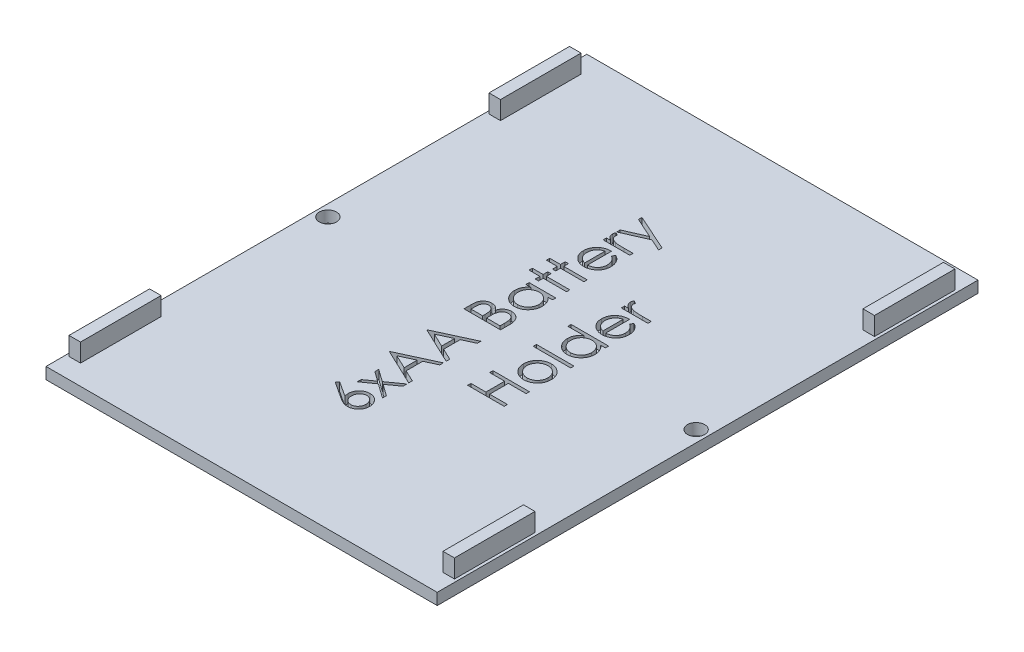
from build123d import *

# Parameters (mm, degrees)
SKETCH1_W               = 68
SKETCH1_H               = 94
BOSS_EXTRUDE1_DEPTH     = 2
SKETCH2_W               = 2
SKETCH2_H               = 14
BOSS_EXTRUDE2_DEPTH     = 3.175
MIRROR2_COPY_1_SKETCH_W = 2
MIRROR2_COPY_1_SKETCH_H = 14
MIRROR2_COPY_1_DEPTH    = 3.175
SKETCH3_W               = 6.512820513
SKETCH3_H               = 0.569871795
CUT_EXTRUDE1_DEPTH      = 1.5
SKETCH4_R               = 1.5
CUT_EXTRUDE2_DEPTH      = 59.095444238


with BuildPart() as part:
    # Sketch1 → Boss-Extrude1 (new body)
    with BuildSketch(Plane(origin=(0, 0, 0), x_dir=(1, 0, 0), z_dir=(0, 1, 0))):
        Rectangle(SKETCH1_W, SKETCH1_H)
    extrude(amount=BOSS_EXTRUDE1_DEPTH)

    # Sketch2 → Boss-Extrude2 (add)
    with BuildSketch(Plane(origin=(0, 2, 0), x_dir=(1, 0, 0), z_dir=(0, 1, 0))):
        with Locations((-32.5, -36.5)):
            Rectangle(SKETCH2_W, SKETCH2_H)
    boss_extrude2 = extrude(amount=BOSS_EXTRUDE2_DEPTH)

    # Mirror1: Boss-Extrude2 across plane
    add(boss_extrude2.mirror(Plane(origin=(0, 0, 0), x_dir=(0, 0, 1), z_dir=(1, 0, 0))))

    # Mirror2: Boss-Extrude2 across plane
    add(boss_extrude2.mirror(Plane.XY))

    # Mirror2 copy 1 sketch → Mirror2 copy 1 (add)
    with BuildSketch(Plane(origin=(0, 2, 0), x_dir=(-1, 0, 0), z_dir=(0, 1, 0))):
        with Locations((-32.5, -36.5)):
            Rectangle(MIRROR2_COPY_1_SKETCH_W, MIRROR2_COPY_1_SKETCH_H)
    extrude(amount=MIRROR2_COPY_1_DEPTH)

    # Sketch3 → Cut-Extrude1 (cut)
    # profile 1 of 17: a face of its own
    with BuildSketch(Plane(origin=(0, 2, 0), x_dir=(1, 0, 0), z_dir=(0, 1, 0))):
        with BuildLine():
            Line((-6.512820513, -24.219551282), (-6.168098958, -23.780699119))
            Line((-6.168098958, -23.780699119), (-3.602403846, -25.458513622))
            add(Edge.make_bspline(
                [(-3.602403846, -25.458513622), (-3.620208993, -25.346807548), (-3.654939946, -25.12891222), (-3.660669361, -24.908356947), (-3.663461538, -24.800871394)],
                knots=[0, 0, 0, 0, 1.025318673, 2, 2, 2, 2], degree=3))
            add(Edge.make_bspline(
                [(-3.663461538, -24.800871394), (-3.661726879, -24.736332722), (-3.658312253, -24.609290267), (-3.632034408, -24.422769356), (-3.590623137, -24.243537994), (-3.530257747, -24.072339094), (-3.453146375, -23.908558018), (-3.360728551, -23.751255458), (-3.24823314, -23.603386152), (-3.122564373, -23.463054304), (-2.983386582, -23.335622589), (-2.835669698, -23.222888692), (-2.679425403, -23.127675498), (-2.514688834, -23.051818618), (-2.342749525, -22.991195538), (-2.162936901, -22.948039283), (-1.974947478, -22.922239824), (-1.847076122, -22.918756567), (-1.782121394, -22.916987179)],
                knots=[0, 0, 0, 0, 1.043709831, 2.054511743, 3.041122595, 4.01515914, 4.98481438, 5.965901842, 6.960491961, 7.985277438, 9.0096037, 10.00832444, 10.987059228, 11.962929573, 12.936966118, 13.931840027, 14.949438142, 16, 16, 16, 16], degree=3))
            add(Edge.make_bspline(
                [(-1.782121394, -22.916987179), (-1.693254891, -22.919562824), (-1.518386645, -22.924631081), (-1.263750699, -22.975346177), (-1.021308894, -23.053564229), (-0.795256357, -23.167153875), (-0.584027426, -23.305570811), (-0.397481311, -23.476442176), (-0.231111911, -23.67129028), (-0.092049871, -23.891725732), (0.021534013, -24.128924395), (0.103112731, -24.378121868), (0.153338738, -24.636887813), (0.159635364, -24.812519092), (0.162820513, -24.901362179)],
                knots=[0, 0, 0, 0, 1.031403119, 2.029557249, 3.004870281, 3.983165322, 4.960181699, 5.929903783, 6.912123683, 7.928973898, 8.949315281, 9.960468141, 10.968302741, 12, 12, 12, 12], degree=3))
            add(Edge.make_bspline(
                [(0.162820513, -24.901362179), (0.16005579, -24.986812647), (0.154579358, -25.156075062), (0.105540204, -25.40500196), (0.026621437, -25.64461393), (-0.08438306, -25.871835219), (-0.22222742, -26.082670775), (-0.387017086, -26.272802056), (-0.578980993, -26.437133395), (-0.793919816, -26.575122257), (-1.024564459, -26.685030357), (-1.265475824, -26.766681932), (-1.515642512, -26.814628054), (-1.685247148, -26.821312624), (-1.770673077, -26.824679487)],
                knots=[0, 0, 0, 0, 1.012172929, 2.004937354, 2.995255351, 3.995689452, 4.993936421, 5.973737378, 6.968231049, 7.979117505, 8.993136101, 9.989812463, 10.987515067, 12, 12, 12, 12], degree=3))
            add(Edge.make_bspline(
                [(-1.770673077, -26.824679487), (-1.836068249, -26.822536008), (-1.969592697, -26.818159434), (-2.17182029, -26.787600712), (-2.378741538, -26.738497441), (-2.55428129, -26.683505994), (-2.698084337, -26.625402387), (-2.814023527, -26.577047066), (-2.933332902, -26.516859959), (-3.060103642, -26.452682538), (-3.191068641, -26.378737933), (-3.328416727, -26.298336684), (-3.469963539, -26.209255889), (-3.566019436, -26.146807879), (-3.615124199, -26.114883814)],
                knots=[0, 0, 0, 0, 1.173818275, 2.396712641, 3.66331629, 4.989737886, 5.693666774, 6.447286557, 7.243889047, 8.091586357, 8.998013824, 9.943181721, 10.948533338, 12, 12, 12, 12], degree=3))
            Line((-3.615124199, -26.114883814), (-6.512820513, -24.219551282))
        make_face()
        with BuildLine():
            add(Edge.make_bspline(
                [(-3.012179487, -24.920442708), (-3.010781522, -24.968820351), (-3.008050889, -25.06331594), (-2.991848738, -25.201874902), (-2.962358978, -25.333437386), (-2.921468854, -25.458041579), (-2.871056118, -25.57645616), (-2.806372151, -25.686334481), (-2.731030092, -25.789937588), (-2.645166241, -25.885610176), (-2.551220259, -25.972373813), (-2.450579493, -26.047086821), (-2.34568884, -26.111534949), (-2.235666812, -26.163934729), (-2.120556793, -26.204738177), (-2.000887853, -26.234253425), (-1.875857616, -26.250679519), (-1.791071504, -26.253412253), (-1.747776442, -26.254807692)],
                knots=[0, 0, 0, 0, 1.129656352, 2.206547016, 3.251334079, 4.271920891, 5.265058649, 6.249872215, 7.241923875, 8.251504132, 9.246416584, 10.222533834, 11.173322129, 12.116503788, 13.062124155, 14.020151864, 14.989013135, 16, 16, 16, 16], degree=3))
            add(Edge.make_bspline(
                [(-1.747776442, -26.254807692), (-1.704876118, -26.253631051), (-1.620335767, -26.251312336), (-1.496239164, -26.231570807), (-1.377091092, -26.200016032), (-1.26333933, -26.154433033), (-1.152800145, -26.099040609), (-1.048924161, -26.027940169), (-0.948346618, -25.946337521), (-0.855740682, -25.851058975), (-0.769769105, -25.74802515), (-0.694312993, -25.638176481), (-0.630507026, -25.523166922), (-0.577636733, -25.403327711), (-0.538716656, -25.277177481), (-0.50892122, -25.146764595), (-0.49263165, -25.010315936), (-0.48986982, -24.917937768), (-0.488461538, -24.870833333)],
                knots=[0, 0, 0, 0, 0.989367052, 1.949669134, 2.891858276, 3.827522767, 4.772653562, 5.738670152, 6.725809442, 7.756636004, 8.798867547, 9.819240912, 10.826537776, 11.829883227, 12.835515726, 13.868058748, 14.912904531, 16, 16, 16, 16], degree=3))
            add(Edge.make_bspline(
                [(-0.488461538, -24.870833333), (-0.489869929, -24.823728976), (-0.492631974, -24.73135096), (-0.508919986, -24.594901202), (-0.538721179, -24.464492372), (-0.577620345, -24.338327408), (-0.63056819, -24.218542843), (-0.693913695, -24.103633816), (-0.77023176, -23.994824076), (-0.85559307, -23.891723198), (-0.948875787, -23.796840615), (-1.048017908, -23.71331876), (-1.153631311, -23.644439651), (-1.262904692, -23.586850957), (-1.377159035, -23.541772676), (-1.496220621, -23.510062552), (-1.620340605, -23.49036302), (-1.704877747, -23.488038541), (-1.747776442, -23.486858974)],
                knots=[0, 0, 0, 0, 1.087281468, 2.132306021, 3.165025708, 4.170830268, 5.174347389, 6.181816599, 7.194310624, 8.23672049, 9.267723423, 10.261267456, 11.222032883, 12.171822355, 13.107646935, 14.049997283, 15.01046367, 16, 16, 16, 16], degree=3))
            add(Edge.make_bspline(
                [(-1.747776442, -23.486858974), (-1.791127985, -23.487857363), (-1.876212965, -23.489816875), (-2.000831925, -23.511980098), (-2.121164814, -23.542718399), (-2.236455265, -23.589133348), (-2.346248664, -23.649433851), (-2.451098302, -23.722882648), (-2.551813218, -23.807849017), (-2.64535008, -23.906002456), (-2.730937004, -24.01282699), (-2.806268533, -24.126499802), (-2.870571835, -24.244948134), (-2.921312231, -24.369840505), (-2.96218927, -24.499496498), (-2.991743596, -24.634811406), (-3.008008654, -24.775881469), (-3.010771501, -24.871641866), (-3.012179487, -24.920442708)],
                knots=[0, 0, 0, 0, 0.978259475, 1.920005202, 2.851759169, 3.7803069, 4.719124913, 5.675758531, 6.668034766, 7.691045932, 8.733780038, 9.756656648, 10.768121246, 11.773215211, 12.79725739, 13.836288844, 14.897342417, 16, 16, 16, 16], degree=3))
        make_face(mode=Mode.SUBTRACT)
    # profile 2 of 17: a face of its own
    with BuildSketch(Plane(origin=(0, 2, 0), x_dir=(1, 0, 0), z_dir=(0, 1, 0))):
        Polygon((-4.640384615, -22.265705128), (-4.640384615, -21.587710337), (-2.966386218, -20.393269231), (-4.640384615, -19.198828125), (-4.640384615, -18.520833333), (-2.491917067, -20.053635817), (0, -18.276602564), (0, -18.954597356), (-2.016175881, -20.393269231), (0, -21.831941106), (0, -22.509935897), (-2.491917067, -20.731630609), align=None)
    # profile 3 of 17: a face of its own
    with BuildSketch(Plane(origin=(0, 2, 0), x_dir=(1, 0, 0), z_dir=(0, 1, 0))):
        Polygon((-6.35, -14.857371795), (0, -11.926602564), (0, -12.546083734), (-2.03525641, -13.484845753), (-2.03525641, -16.363461538), (0, -17.328936298), (0, -17.950961538), (-6.35, -14.938782051), align=None)
        Polygon((-5.112309696, -14.904437099), (-2.686538462, -16.054356971), (-2.686538462, -13.785046074), align=None, mode=Mode.SUBTRACT)
    # profile 4 of 17: a face of its own
    with BuildSketch(Plane(origin=(0, 2, 0), x_dir=(1, 0, 0), z_dir=(0, 1, 0))):
        Polygon((-6.35, -8.344551282), (0, -5.413782051), (0, -6.033263221), (-2.03525641, -6.97202524), (-2.03525641, -9.850641026), (0, -10.816115785), (0, -11.438141026), (-6.35, -8.425961538), align=None)
        Polygon((-5.112309696, -8.391616587), (-2.686538462, -9.541536458), (-2.686538462, -7.272225561), align=None, mode=Mode.SUBTRACT)
    # profile 5 of 17: a face of its own
    with BuildSketch(Plane(origin=(0, 2, 0), x_dir=(1, 0, 0), z_dir=(0, 1, 0))):
        with BuildLine():
            Line((-6.35, -1.994551282), (-6.35, -0.755588942))
            add(Edge.make_bspline(
                [(-6.35, -0.755588942), (-6.349686158, -0.694939175), (-6.349077855, -0.577384833), (-6.339424525, -0.406456844), (-6.326591336, -0.246303258), (-6.305064352, -0.097207087), (-6.282743708, 0.041801818), (-6.249982348, 0.169312222), (-6.213796231, 0.286392184), (-6.15811898, 0.426981255), (-6.071651506, 0.58649882), (-5.943412027, 0.757950354), (-5.789663247, 0.906986488), (-5.614454384, 1.03371138), (-5.421704781, 1.135410801), (-5.215561507, 1.208055045), (-4.999492675, 1.254724474), (-4.851357514, 1.259463797), (-4.776492388, 1.261858974)],
                knots=[0, 0, 0, 0, 1.00128172, 1.940733171, 2.826250472, 3.653024905, 4.427672124, 5.149348099, 5.824709082, 6.450061444, 7.643590664, 8.808605388, 9.972104426, 11.165284501, 12.367876273, 13.557044126, 14.765369432, 16, 16, 16, 16], degree=3))
            add(Edge.make_bspline(
                [(-4.776492388, 1.261858974), (-4.706368692, 1.259863966), (-4.568569016, 1.255943587), (-4.367368648, 1.218912255), (-4.176038859, 1.160138239), (-3.994743401, 1.078910178), (-3.826857102, 0.974252366), (-3.672900029, 0.848857596), (-3.538690913, 0.698196782), (-3.463688681, 0.585260928), (-3.425590946, 0.527894631)],
                knots=[0, 0, 0, 0, 1.044641374, 2.052818814, 3.038628718, 4.023282556, 5.005660861, 5.98021751, 6.974042014, 8, 8, 8, 8], degree=3))
            add(Edge.make_bspline(
                [(-3.425590946, 0.527894631), (-3.397886908, 0.600024442), (-3.344882222, 0.738026636), (-3.251317083, 0.928047342), (-3.14918179, 1.091165211), (-3.039368108, 1.230566668), (-2.919254902, 1.349161224), (-2.787866309, 1.451870966), (-2.645309891, 1.54066554), (-2.492109588, 1.616229108), (-2.329564148, 1.675585233), (-2.159658903, 1.719211163), (-1.983045186, 1.745016848), (-1.863191581, 1.748537139), (-1.802473958, 1.750320513)],
                knots=[0, 0, 0, 0, 1.272586185, 2.434772614, 3.483318042, 4.437947805, 5.351807173, 6.25737843, 7.180033415, 8.1141739, 9.066731021, 10.025721652, 10.999834114, 12, 12, 12, 12], degree=3))
            add(Edge.make_bspline(
                [(-1.802473958, 1.750320513), (-1.740485238, 1.748548622), (-1.618520694, 1.745062378), (-1.439354268, 1.719330325), (-1.268117908, 1.67579128), (-1.103782939, 1.615715955), (-0.946693913, 1.537848334), (-0.797419911, 1.441716397), (-0.65565037, 1.328669644), (-0.521135084, 1.20090854), (-0.398049369, 1.058528784), (-0.292237163, 0.90161713), (-0.201253746, 0.734472191), (-0.127178292, 0.55495718), (-0.070029129, 0.36353036), (-0.030211881, 0.160298252), (-0.003338063, -0.054404451), (-0.001131568, -0.201743221), (0, -0.277303686)],
                knots=[0, 0, 0, 0, 0.978680899, 1.925582087, 2.851223405, 3.764209995, 4.683484765, 5.614004905, 6.562443559, 7.542772147, 8.539900013, 9.527881485, 10.525548727, 11.540192123, 12.58875426, 13.674701727, 14.807505862, 16, 16, 16, 16], degree=3))
            Line((0, -0.277303686), (0, -1.994551282))
            Line((0, -1.994551282), (-6.35, -1.994551282))
        make_face()
        with BuildLine():
            Line((-5.698717949, -1.424679487), (-3.663461538, -1.424679487))
            Line((-3.663461538, -1.424679487), (-3.663461538, -1.041796875))
            add(Edge.make_bspline(
                [(-3.663461538, -1.041796875), (-3.664187113, -0.985828346), (-3.665589071, -0.877685743), (-3.669605025, -0.721076789), (-3.680850041, -0.575707108), (-3.692091847, -0.441827658), (-3.710369976, -0.319649163), (-3.732127283, -0.209442641), (-3.755137147, -0.109477404), (-3.794272678, 0.005798787), (-3.852092151, 0.136578019), (-3.941910369, 0.275902883), (-4.048805389, 0.399299377), (-4.173301164, 0.502251206), (-4.308898954, 0.587253311), (-4.454408338, 0.646799959), (-4.606901127, 0.686497937), (-4.711789768, 0.690138689), (-4.765044071, 0.691987179)],
                knots=[0, 0, 0, 0, 1.156917035, 2.235399477, 3.236897345, 4.169954739, 5.01148057, 5.788325709, 6.491867502, 7.129259015, 8.302032419, 9.437271567, 10.542795419, 11.662606952, 12.764338259, 13.836858145, 14.901724648, 16, 16, 16, 16], degree=3))
            add(Edge.make_bspline(
                [(-4.765044071, 0.691987179), (-4.80029259, 0.691048629), (-4.869436411, 0.689207561), (-4.970559604, 0.673581439), (-5.065578315, 0.648262973), (-5.155404483, 0.613974944), (-5.237805714, 0.56713241), (-5.31671935, 0.512835758), (-5.387418853, 0.445798832), (-5.453307969, 0.370041154), (-5.512278508, 0.283360858), (-5.56112646, 0.183890416), (-5.605398934, 0.07420129), (-5.638172531, -0.048682445), (-5.666991771, -0.182214597), (-5.685099092, -0.32820324), (-5.696751325, -0.485723275), (-5.698047786, -0.594864876), (-5.698717949, -0.651282051)],
                knots=[0, 0, 0, 0, 0.911708768, 1.788416306, 2.640049961, 3.452993646, 4.268229297, 5.087074648, 5.92553149, 6.781184137, 7.681934069, 8.628939405, 9.643570426, 10.73771997, 11.914765019, 13.176320755, 14.540391495, 16, 16, 16, 16], degree=3))
            Line((-5.698717949, -0.651282051), (-5.698717949, -1.424679487))
        make_face(mode=Mode.SUBTRACT)
        with BuildLine():
            Line((-3.012179487, -1.424679487), (-0.651282051, -1.424679487))
            Line((-0.651282051, -1.424679487), (-0.651282051, -0.613120994))
            add(Edge.make_bspline(
                [(-0.651282051, -0.613120994), (-0.652047507, -0.555035589), (-0.653522822, -0.44308363), (-0.656982743, -0.281316944), (-0.670071099, -0.131775486), (-0.682145048, 0.006012492), (-0.702790982, 0.131681302), (-0.722275376, 0.246197594), (-0.751198566, 0.347681504), (-0.790950089, 0.466441159), (-0.854587342, 0.599187003), (-0.947560769, 0.744254316), (-1.062304329, 0.870750765), (-1.192803399, 0.979336158), (-1.334304214, 1.06894554), (-1.484956921, 1.133248748), (-1.641831611, 1.173209054), (-1.748818713, 1.178030639), (-1.802473958, 1.180448718)],
                knots=[0, 0, 0, 0, 1.160376723, 2.23647316, 3.230273494, 4.158083346, 4.997711197, 5.773399541, 6.476071462, 7.102777513, 8.27340052, 9.405620712, 10.53304798, 11.669441455, 12.787990954, 13.865552736, 14.929550474, 16, 16, 16, 16], degree=3))
            add(Edge.make_bspline(
                [(-1.802473958, 1.180448718), (-1.836026884, 1.17994932), (-1.902591525, 1.178958579), (-2.00039969, 1.163949098), (-2.09519127, 1.142235136), (-2.187361275, 1.113637223), (-2.275359988, 1.073658882), (-2.359524886, 1.024648787), (-2.441551442, 0.968548026), (-2.546593553, 0.881995162), (-2.666116905, 0.754265216), (-2.781692172, 0.572746708), (-2.876404985, 0.367493317), (-2.916445508, 0.218277136), (-2.937129407, 0.141195913)],
                knots=[0, 0, 0, 0, 0.723302347, 1.434937762, 2.129609326, 2.821140842, 3.513216847, 4.209993937, 4.920569932, 5.655069131, 7.14393391, 8.6716197, 10.280644748, 12, 12, 12, 12], degree=3))
            add(Edge.make_bspline(
                [(-2.937129407, 0.141195913), (-2.943397917, 0.110300268), (-2.956989338, 0.043312136), (-2.971336171, -0.065921617), (-2.984117923, -0.190628122), (-2.993572452, -0.331095342), (-3.003345181, -0.487500996), (-3.007145785, -0.66017912), (-3.011680157, -0.848424534), (-3.012008786, -0.979039267), (-3.012179487, -1.046885016)],
                knots=[0, 0, 0, 0, 0.634451884, 1.375622551, 2.216452059, 3.157844607, 4.20941857, 5.370758133, 6.634282058, 8, 8, 8, 8], degree=3))
            Line((-3.012179487, -1.046885016), (-3.012179487, -1.424679487))
        make_face(mode=Mode.SUBTRACT)
    # profile 6 of 17: a face of its own
    with BuildSketch(Plane(origin=(0, 2, 0), x_dir=(1, 0, 0), z_dir=(0, 1, 0))):
        with BuildLine():
            Line((-4.640384615, 7.611858974), (0, 7.611858974))
            Line((0, 7.611858974), (0, 7.041987179))
            Line((0, 7.041987179), (-0.802654247, 7.041987179))
            add(Edge.make_bspline(
                [(-0.802654247, 7.041987179), (-0.73013068, 6.977627053), (-0.588389557, 6.851840678), (-0.401516704, 6.643733369), (-0.250200979, 6.42039739), (-0.126216077, 6.187436897), (-0.033459119, 5.942569983), (0.032588195, 5.687076491), (0.075022466, 5.420712325), (0.07926189, 5.238826785), (0.081410256, 5.146654647)],
                knots=[0, 0, 0, 0, 1.074325654, 2.099677833, 3.090439787, 4.057542011, 5.018572219, 5.985274637, 6.979019747, 8, 8, 8, 8], degree=3))
            add(Edge.make_bspline(
                [(0.081410256, 5.146654647), (0.079185267, 5.064707074), (0.074797489, 4.903102831), (0.040757309, 4.665378648), (-0.013908247, 4.436611281), (-0.089928433, 4.216584557), (-0.190767923, 4.006722236), (-0.311492759, 3.805227489), (-0.455258265, 3.613144176), (-0.619610831, 3.433400098), (-0.79812745, 3.267879183), (-0.988528657, 3.12262516), (-1.189991122, 3.001516001), (-1.39996413, 2.900242426), (-1.620064056, 2.822234772), (-1.849529775, 2.767854036), (-2.088089974, 2.733853511), (-2.250540251, 2.729467547), (-2.33291266, 2.72724359)],
                knots=[0, 0, 0, 0, 1.033919861, 2.038935746, 3.024066025, 3.998881131, 4.97069526, 5.957263378, 6.95902576, 7.993208707, 9.027059324, 10.027763471, 11.009749337, 11.988697705, 12.965288445, 13.950418724, 14.960734635, 16, 16, 16, 16], degree=3))
            add(Edge.make_bspline(
                [(-2.33291266, 2.72724359), (-2.413582522, 2.729516838), (-2.573062488, 2.734010927), (-2.807610983, 2.76749034), (-3.033522685, 2.823789456), (-3.250070282, 2.902797693), (-3.457515801, 3.004110955), (-3.656005961, 3.127351912), (-3.846087582, 3.272529467), (-4.023291094, 3.439901691), (-4.186977065, 3.621211917), (-4.329233476, 3.815174901), (-4.452091188, 4.016965711), (-4.549433923, 4.229714316), (-4.628190441, 4.450271777), (-4.682678826, 4.6806016), (-4.714786824, 4.919745464), (-4.71943641, 5.082106786), (-4.721794872, 5.164463141)],
                knots=[0, 0, 0, 0, 1.020392517, 2.01726096, 2.990465484, 3.961182959, 4.928053699, 5.906110375, 6.912531644, 7.948652711, 8.985773172, 9.998621852, 10.987621588, 11.969261332, 12.953316658, 13.946091881, 14.958173133, 16, 16, 16, 16], degree=3))
            add(Edge.make_bspline(
                [(-4.721794872, 5.164463141), (-4.719183474, 5.259166806), (-4.714062647, 5.444876223), (-4.671535636, 5.716550972), (-4.599470314, 5.973442036), (-4.502118868, 6.218276561), (-4.370045566, 6.447684464), (-4.208102076, 6.664521532), (-4.009593081, 6.864174542), (-3.859018636, 6.981690994), (-3.781760817, 7.041987179)],
                knots=[0, 0, 0, 0, 1.039007978, 2.037445607, 3.008437381, 3.96246474, 4.921201921, 5.904967172, 6.925065498, 8, 8, 8, 8], degree=3))
            Line((-3.781760817, 7.041987179), (-4.640384615, 7.041987179))
            Line((-4.640384615, 7.041987179), (-4.640384615, 7.611858974))
        make_face()
        with BuildLine():
            add(Edge.make_bspline(
                [(-4.151923077, 5.172095353), (-4.148956655, 5.088795418), (-4.143101409, 4.924374597), (-4.097466181, 4.682968838), (-4.02133771, 4.452083352), (-3.917832134, 4.232077167), (-3.785211951, 4.029085297), (-3.628960889, 3.844482747), (-3.446441489, 3.683961535), (-3.244185597, 3.54591368), (-3.026158718, 3.435092124), (-2.798319046, 3.35667095), (-2.564609633, 3.30504641), (-2.406111482, 3.299765943), (-2.326552484, 3.297115385)],
                knots=[0, 0, 0, 0, 1.031130969, 2.035288524, 3.029955243, 4.035265425, 5.037320146, 6.024362013, 7.021230137, 8.037832003, 9.049975902, 10.039737725, 11.016035826, 12, 12, 12, 12], degree=3))
            add(Edge.make_bspline(
                [(-2.326552484, 3.297115385), (-2.24747257, 3.300512488), (-2.089622708, 3.307293379), (-1.855933355, 3.355540669), (-1.628605119, 3.437545519), (-1.408826205, 3.548217221), (-1.204594048, 3.687889793), (-1.018796389, 3.84825834), (-0.860101216, 4.03374906), (-0.727161318, 4.238555807), (-0.61984129, 4.457393494), (-0.545150416, 4.687501138), (-0.496931946, 4.924585483), (-0.491299374, 5.085788814), (-0.488461538, 5.167007212)],
                knots=[0, 0, 0, 0, 0.979154007, 1.954470061, 2.941101473, 3.965068436, 4.993389179, 5.998216918, 6.996159742, 8.005560442, 9.015493761, 10.005250788, 10.994993882, 12, 12, 12, 12], degree=3))
            add(Edge.make_bspline(
                [(-0.488461538, 5.167007212), (-0.491507979, 5.249448918), (-0.497567048, 5.413417294), (-0.542944087, 5.655808818), (-0.620757544, 5.890232607), (-0.72533078, 6.115089519), (-0.855579436, 6.324357893), (-1.008065428, 6.511542516), (-1.18418603, 6.671693365), (-1.379993319, 6.805030666), (-1.593287966, 6.910773661), (-1.820144968, 6.988091587), (-2.061024796, 7.033297327), (-2.225871347, 7.03905051), (-2.310016026, 7.041987179)],
                knots=[0, 0, 0, 0, 1.01787422, 2.024450869, 3.03297362, 4.061474925, 5.080076323, 6.069755756, 7.033548292, 8.009625779, 8.9862229, 9.964937832, 10.961217871, 12, 12, 12, 12], degree=3))
            add(Edge.make_bspline(
                [(-2.310016026, 7.041987179), (-2.374128947, 7.040246089), (-2.500323464, 7.036819071), (-2.685611961, 7.010637895), (-2.862928863, 6.9689911), (-3.032460599, 6.910305905), (-3.193269842, 6.833214575), (-3.346511235, 6.740236486), (-3.491387776, 6.629736598), (-3.62590449, 6.503493707), (-3.748598215, 6.365308268), (-3.858116194, 6.219086744), (-3.948084396, 6.063096732), (-4.022544989, 5.899961536), (-4.081798018, 5.729398115), (-4.121327119, 5.550018562), (-4.148469416, 5.363729543), (-4.150759736, 5.236645985), (-4.151923077, 5.172095353)],
                knots=[0, 0, 0, 0, 1.050140795, 2.067009409, 3.05949893, 4.030605086, 5.00011959, 5.97591094, 6.962425594, 7.979863591, 8.993523472, 9.986985069, 10.967611495, 11.937549037, 12.921786183, 13.919465291, 14.943216303, 16, 16, 16, 16], degree=3))
        make_face(mode=Mode.SUBTRACT)
    # profile 7 of 17: a face of its own
    with BuildSketch(Plane(origin=(0, 2, 0), x_dir=(1, 0, 0), z_dir=(0, 1, 0))):
        Polygon((-6.512820513, 9.484294872), (-6.512820513, 10.054166667), (-4.640384615, 10.054166667), (-4.640384615, 10.868269231), (-4.070512821, 10.868269231), (-4.070512821, 10.054166667), (0, 10.054166667), (0, 9.484294872), (-4.070512821, 9.484294872), (-4.070512821, 8.670192308), (-4.640384615, 8.670192308), (-4.640384615, 9.484294872), align=None)
    # profile 8 of 17: a face of its own
    with BuildSketch(Plane(origin=(0, 2, 0), x_dir=(1, 0, 0), z_dir=(0, 1, 0))):
        Polygon((-6.512820513, 12.496474359), (-6.512820513, 13.066346154), (-4.640384615, 13.066346154), (-4.640384615, 13.880448718), (-4.070512821, 13.880448718), (-4.070512821, 13.066346154), (0, 13.066346154), (0, 12.496474359), (-4.070512821, 12.496474359), (-4.070512821, 11.682371795), (-4.640384615, 11.682371795), (-4.640384615, 12.496474359), align=None)
    # profile 9 of 17: a face of its own
    with BuildSketch(Plane(origin=(0, 2, 0), x_dir=(1, 0, 0), z_dir=(0, 1, 0))):
        with BuildLine():
            Line((-1.465384615, 18.747255609), (-1.199529247, 19.253525641))
            add(Edge.make_bspline(
                [(-1.199529247, 19.253525641), (-1.127984738, 19.213160939), (-0.988787456, 19.134627213), (-0.797536398, 19.000121654), (-0.626508157, 18.857830006), (-0.478441385, 18.703422902), (-0.34768004, 18.54155328), (-0.234891068, 18.369146733), (-0.138039348, 18.18761051), (-0.058678401, 17.99494508), (0.003711762, 17.791381237), (0.049787323, 17.57573776), (0.076506771, 17.346996459), (0.079749708, 17.190354727), (0.081410256, 17.110146234)],
                knots=[0, 0, 0, 0, 1.120611642, 2.180266485, 3.186550691, 4.152466804, 5.095166165, 6.022949561, 6.960161436, 7.899497276, 8.862391909, 9.862399089, 10.905440174, 12, 12, 12, 12], degree=3))
            add(Edge.make_bspline(
                [(0.081410256, 17.110146234), (0.079328953, 17.020988646), (0.075268932, 16.847068022), (0.04026689, 16.59390305), (-0.016832964, 16.355543256), (-0.096599007, 16.132001996), (-0.200788619, 15.923826862), (-0.327714964, 15.730603527), (-0.476726885, 15.551318019), (-0.649111794, 15.391611845), (-0.833599584, 15.247859754), (-1.025806118, 15.12092583), (-1.225065762, 15.015298608), (-1.430192967, 14.928064159), (-1.6407216, 14.85925271), (-1.857857385, 14.810354233), (-2.080739315, 14.782426664), (-2.23149849, 14.77812787), (-2.307471955, 14.775961538)],
                knots=[0, 0, 0, 0, 1.14524686, 2.234044844, 3.276713788, 4.290115724, 5.276966211, 6.260758605, 7.254862358, 8.264742877, 9.274005885, 10.257798278, 11.220590477, 12.167824544, 13.118936889, 14.062732937, 15.023735098, 16, 16, 16, 16], degree=3))
            add(Edge.make_bspline(
                [(-2.307471955, 14.775961538), (-2.378764005, 14.777883123), (-2.520055432, 14.781691451), (-2.729180063, 14.80569588), (-2.932431684, 14.848237783), (-3.129979182, 14.906614828), (-3.321491797, 14.98200066), (-3.507086084, 15.074224829), (-3.686564552, 15.183431), (-3.799781666, 15.267745708), (-3.856810897, 15.310216346)],
                knots=[0, 0, 0, 0, 1.024358464, 2.0301432, 3.019427413, 4.004406732, 4.986367066, 5.972626655, 6.978780325, 8, 8, 8, 8], degree=3))
            add(Edge.make_bspline(
                [(-3.856810897, 15.310216346), (-3.925629764, 15.367643967), (-4.060866435, 15.48049558), (-4.236942543, 15.673348274), (-4.387560602, 15.879360018), (-4.510435112, 16.100603043), (-4.604945038, 16.336704677), (-4.672168699, 16.586447126), (-4.713998331, 16.850520672), (-4.719156513, 17.031545977), (-4.721794872, 17.124138622)],
                knots=[0, 0, 0, 0, 1.030811313, 2.025658015, 2.997072178, 3.962767568, 4.930766827, 5.917075773, 6.934604948, 8, 8, 8, 8], degree=3))
            add(Edge.make_bspline(
                [(-4.721794872, 17.124138622), (-4.719350544, 17.219299034), (-4.71455533, 17.405982071), (-4.669702284, 17.678105899), (-4.599437292, 17.936100786), (-4.497064534, 18.177837632), (-4.370166508, 18.407041248), (-4.209773346, 18.618436536), (-4.024123028, 18.817826436), (-3.881201208, 18.933762713), (-3.808473558, 18.992758413)],
                knots=[0, 0, 0, 0, 1.056389096, 2.072394598, 3.055233004, 4.020130009, 4.981825462, 5.957811105, 6.960805292, 8, 8, 8, 8], degree=3))
            add(Edge.make_bspline(
                [(-3.808473558, 18.992758413), (-3.753675631, 19.032903002), (-3.64444453, 19.112924963), (-3.466334003, 19.213158988), (-3.279987638, 19.300167404), (-3.082393242, 19.369714348), (-2.875892004, 19.426028871), (-2.659007673, 19.466771957), (-2.431804834, 19.490665408), (-2.276998083, 19.495362044), (-2.198076923, 19.49775641)],
                knots=[0, 0, 0, 0, 0.94817472, 1.890038105, 2.849395472, 3.817997239, 4.812318967, 5.836947057, 6.897266129, 8, 8, 8, 8], degree=3))
            Line((-2.198076923, 19.49775641), (-2.198076923, 15.345833333))
            add(Edge.make_bspline(
                [(-2.198076923, 15.345833333), (-2.136934652, 15.348626619), (-2.016700843, 15.354119503), (-1.840768136, 15.379728406), (-1.673176501, 15.420094038), (-1.515182982, 15.476825052), (-1.364724036, 15.545526329), (-1.222915769, 15.629683272), (-1.090404096, 15.730085034), (-0.966003718, 15.842073089), (-0.855222051, 15.96672739), (-0.756068114, 16.097868946), (-0.672963675, 16.237375842), (-0.605508732, 16.384148079), (-0.552701558, 16.537948318), (-0.516655655, 16.698825015), (-0.492512761, 16.866461598), (-0.489828226, 16.980735715), (-0.488461538, 17.03891226)],
                knots=[0, 0, 0, 0, 1.094153842, 2.151609401, 3.174256925, 4.172055639, 5.149267565, 6.128595816, 7.11444997, 8.118368179, 9.117203808, 10.09244225, 11.054858984, 12.015122123, 12.976791628, 13.957293641, 14.960065497, 16, 16, 16, 16], degree=3))
            add(Edge.make_bspline(
                [(-0.488461538, 17.03891226), (-0.489555843, 17.095794681), (-0.491727154, 17.208660316), (-0.513143055, 17.376700741), (-0.547085398, 17.542310229), (-0.595972696, 17.703844323), (-0.653219063, 17.858948866), (-0.720597667, 18.003377653), (-0.797416902, 18.135221264), (-0.88471234, 18.25892713), (-0.99184677, 18.378266139), (-1.124255561, 18.498525178), (-1.283440498, 18.624628421), (-1.402454333, 18.704841687), (-1.465384615, 18.747255609)],
                knots=[0, 0, 0, 0, 0.991168677, 1.966668791, 2.94808785, 3.9350306, 4.905702032, 5.828266021, 6.709360349, 7.562606342, 8.463112863, 9.498839253, 10.677475166, 12, 12, 12, 12], degree=3))
        make_face()
        with BuildLine():
            add(Edge.make_bspline(
                [(-2.767948718, 18.927884615), (-2.843574848, 18.90711092), (-2.988752449, 18.867232175), (-3.189718084, 18.782303456), (-3.369353734, 18.688961996), (-3.524674257, 18.576597244), (-3.662840511, 18.450528303), (-3.781651866, 18.302898525), (-3.891158015, 18.140110783), (-3.982350567, 17.958922674), (-4.057288895, 17.766479354), (-4.112391731, 17.566736293), (-4.144782829, 17.361366521), (-4.149531806, 17.223045003), (-4.151923077, 17.153395433)],
                knots=[0, 0, 0, 0, 1.155085888, 2.217389643, 3.210301801, 4.133263417, 5.03575695, 5.95948047, 6.920061569, 7.923798377, 8.943125483, 9.960783337, 10.973185325, 12, 12, 12, 12], degree=3))
            add(Edge.make_bspline(
                [(-4.151923077, 17.153395433), (-4.150826271, 17.096514248), (-4.148658116, 16.984072104), (-4.127661051, 16.818488677), (-4.093921099, 16.659057717), (-4.044311695, 16.506255116), (-3.983946855, 16.35906728), (-3.909746252, 16.217600564), (-3.820036425, 16.083673547), (-3.751507557, 15.999969351), (-3.716887019, 15.957682292)],
                knots=[0, 0, 0, 0, 1.048823158, 2.073302879, 3.073550078, 4.050623576, 5.03253758, 6.005186856, 6.992227572, 8, 8, 8, 8], degree=3))
            add(Edge.make_bspline(
                [(-3.716887019, 15.957682292), (-3.689504496, 15.927391162), (-3.634088944, 15.866089298), (-3.538559601, 15.78426558), (-3.435489033, 15.705338001), (-3.320378115, 15.635199346), (-3.196564939, 15.568542967), (-3.06314607, 15.507801724), (-2.919558345, 15.452572972), (-2.819452024, 15.421569727), (-2.767948718, 15.40561899)],
                knots=[0, 0, 0, 0, 0.879905587, 1.780714457, 2.708106151, 3.677566983, 4.684151534, 5.740052498, 6.837288539, 8, 8, 8, 8], degree=3))
            Line((-2.767948718, 15.40561899), (-2.767948718, 18.927884615))
        make_face(mode=Mode.SUBTRACT)
    # profile 10 of 17: a face of its own
    with BuildSketch(Plane(origin=(0, 2, 0), x_dir=(1, 0, 0), z_dir=(0, 1, 0))):
        with BuildLine():
            Line((-4.640384615, 20.474679487), (-4.640384615, 21.044551282))
            Line((-4.640384615, 21.044551282), (-3.957301683, 21.044551282))
            add(Edge.make_bspline(
                [(-3.957301683, 21.044551282), (-4.020931444, 21.086595397), (-4.142622868, 21.16700444), (-4.303351562, 21.301279395), (-4.437948256, 21.437350051), (-4.54384617, 21.578789373), (-4.623879133, 21.72421066), (-4.68011579, 21.87238765), (-4.714989852, 22.02368269), (-4.719523493, 22.125601028), (-4.721794872, 22.17666266)],
                knots=[0, 0, 0, 0, 1.280091057, 2.448164201, 3.510831157, 4.48793739, 5.405868014, 6.289422536, 7.142991551, 8, 8, 8, 8], degree=3))
            add(Edge.make_bspline(
                [(-4.721794872, 22.17666266), (-4.719634916, 22.216261853), (-4.715190668, 22.297739764), (-4.683965315, 22.421079606), (-4.634112331, 22.54815844), (-4.587230784, 22.630059628), (-4.562790465, 22.67275641)],
                knots=[0, 0, 0, 0, 0.901110191, 1.854092781, 2.881294221, 4, 4, 4, 4], degree=3))
            Line((-4.562790465, 22.67275641), (-4.069240785, 22.359835737))
            add(Edge.make_bspline(
                [(-4.069240785, 22.359835737), (-4.081469554, 22.332423656), (-4.104682097, 22.280390278), (-4.13215403, 22.204272708), (-4.148330049, 22.134093711), (-4.150780636, 22.089383255), (-4.151923077, 22.068539663)],
                knots=[0, 0, 0, 0, 1.180555205, 2.24091978, 3.179933427, 4, 4, 4, 4], degree=3))
            add(Edge.make_bspline(
                [(-4.151923077, 22.068539663), (-4.148898879, 22.022795531), (-4.142730393, 21.929490762), (-4.0935439, 21.792963342), (-4.016359072, 21.659295162), (-3.928468373, 21.554160509), (-3.84404167, 21.472468912), (-3.770149688, 21.413718389), (-3.6865278, 21.360988919), (-3.596408178, 21.309839933), (-3.497529077, 21.262318664), (-3.389729188, 21.219851429), (-3.273898681, 21.180136389), (-3.19335903, 21.157770708), (-3.152103365, 21.146314103)],
                knots=[0, 0, 0, 0, 1.125322384, 2.295331465, 3.535939348, 4.916963136, 5.656144286, 6.429838446, 7.238666481, 8.090384391, 8.983239461, 9.940052224, 10.944811494, 12, 12, 12, 12], degree=3))
            add(Edge.make_bspline(
                [(-3.152103365, 21.146314103), (-3.115316816, 21.13771335), (-3.033428807, 21.118567807), (-2.896672667, 21.100449638), (-2.73520373, 21.081827113), (-2.548834415, 21.069109804), (-2.336848316, 21.05709661), (-2.100159942, 21.050460026), (-1.838118749, 21.044762435), (-1.655346046, 21.044623912), (-1.559515224, 21.044551282)],
                knots=[0, 0, 0, 0, 0.566841273, 1.261806378, 2.068780918, 3.007109044, 4.065315289, 5.256255371, 6.561408263, 8, 8, 8, 8], degree=3))
            Line((-1.559515224, 21.044551282), (0, 21.044551282))
            Line((0, 21.044551282), (0, 20.474679487))
            Line((0, 20.474679487), (-4.640384615, 20.474679487))
        make_face()
    # profile 11 of 17: a face of its own
    with BuildSketch(Plane(origin=(0, 2, 0), x_dir=(1, 0, 0), z_dir=(0, 1, 0))):
        Polygon((-4.640384615, 22.835576923), (-4.640384615, 23.449969952), (-1.086318109, 25.020933494), (-4.640384615, 26.616065705), (-4.640384615, 27.231730769), (1.709615385, 24.382371795), (1.709615385, 23.766706731), (-0.395602965, 24.711828926), align=None)
    # profile 12 of 17: a face of its own
    with BuildSketch(Plane(origin=(0, 2, 0), x_dir=(1, 0, 0), z_dir=(0, 1, 0))):
        Polygon((5.477564103, -13.188461538), (5.477564103, -12.618589744), (8.082692308, -12.618589744), (8.082692308, -9.362179487), (5.477564103, -9.362179487), (5.477564103, -8.792307692), (11.827564103, -8.792307692), (11.827564103, -9.362179487), (8.733974359, -9.362179487), (8.733974359, -12.618589744), (11.827564103, -12.618589744), (11.827564103, -13.188461538), align=None)
    # profile 13 of 17: a face of its own
    with BuildSketch(Plane(origin=(0, 2, 0), x_dir=(1, 0, 0), z_dir=(0, 1, 0))):
        with BuildLine():
            add(Edge.make_bspline(
                [(7.105769231, -5.085596955), (7.107623233, -4.998527074), (7.111258479, -4.827804317), (7.150111345, -4.577781438), (7.209524421, -4.339120978), (7.291659969, -4.110908886), (7.401754365, -3.896067893), (7.533125507, -3.691468636), (7.688759642, -3.497672062), (7.809152137, -3.381515995), (7.87026242, -3.32255609)],
                knots=[0, 0, 0, 0, 1.054011418, 2.066658804, 3.057071809, 4.030435133, 4.997543892, 5.974964718, 6.972108034, 8, 8, 8, 8], degree=3))
            add(Edge.make_bspline(
                [(7.87026242, -3.32255609), (7.928707794, -3.27178883), (8.044467464, -3.171236798), (8.232165504, -3.042303279), (8.426548258, -2.931229877), (8.630196979, -2.842215648), (8.841333883, -2.772029962), (9.060684674, -2.722199342), (9.287764933, -2.692559474), (9.441986182, -2.688562663), (9.520092147, -2.686538462)],
                knots=[0, 0, 0, 0, 1.025258237, 2.030674902, 3.01204498, 3.988269485, 4.97094183, 5.956517959, 6.965070386, 8, 8, 8, 8], degree=3))
            add(Edge.make_bspline(
                [(9.520092147, -2.686538462), (9.598650824, -2.688318888), (9.753886431, -2.691837093), (9.982521566, -2.725117654), (10.204217887, -2.776881196), (10.418047232, -2.850961817), (10.624663219, -2.945954386), (10.823163401, -3.061870348), (11.013939414, -3.199523139), (11.195371321, -3.355558962), (11.362587167, -3.528010223), (11.508325599, -3.715092378), (11.633187508, -3.913128982), (11.733765005, -4.124753351), (11.81306689, -4.348032934), (11.868765491, -4.583449329), (11.902441689, -4.830636814), (11.906766171, -4.999414773), (11.908974359, -5.085596955)],
                knots=[0, 0, 0, 0, 0.998656419, 1.973391657, 2.932242238, 3.890759089, 4.846373663, 5.82037756, 6.809684879, 7.83454468, 8.860553229, 9.859544525, 10.845671541, 11.83227036, 12.833544569, 13.85385346, 14.904124723, 16, 16, 16, 16], degree=3))
            add(Edge.make_bspline(
                [(11.908974359, -5.085596955), (11.90675876, -5.172201375), (11.902419398, -5.341820506), (11.868896328, -5.589880502), (11.813092559, -5.82571881), (11.733504394, -6.049290696), (11.633184293, -6.261824919), (11.508703085, -6.461008992), (11.362543946, -6.648243124), (11.195383032, -6.820730867), (11.013936397, -6.976756908), (10.823164184, -7.114412224), (10.624663015, -7.23032753), (10.418047286, -7.325320271), (10.204217873, -7.399400846), (9.98252157, -7.4511644), (9.75388643, -7.484444957), (9.598650823, -7.487963163), (9.520092147, -7.48974359)],
                knots=[0, 0, 0, 0, 1.099876186, 2.154163076, 3.173186993, 4.173200201, 5.163417411, 6.152872554, 7.150605724, 8.17532212, 9.198891216, 10.186952605, 11.159729845, 12.11414092, 13.071450619, 14.029093627, 15.002601286, 16, 16, 16, 16], degree=3))
            add(Edge.make_bspline(
                [(9.520092147, -7.48974359), (9.442408967, -7.487710426), (9.288609619, -7.48368511), (9.061981386, -7.454004794), (8.843301935, -7.404716369), (8.633318008, -7.333557708), (8.430158752, -7.244708717), (8.235063286, -7.134753221), (8.048185407, -7.004572486), (7.932579249, -6.904411096), (7.874078526, -6.853725962)],
                knots=[0, 0, 0, 0, 1.031377469, 2.041950136, 3.029500481, 4.003457997, 4.981637986, 5.969878303, 6.97268806, 8, 8, 8, 8], degree=3))
            add(Edge.make_bspline(
                [(7.874078526, -6.853725962), (7.812438279, -6.794854946), (7.691211887, -6.679074736), (7.53603145, -6.484313473), (7.401926574, -6.280217541), (7.294019726, -6.063002317), (7.209041272, -5.834977704), (7.149958123, -5.595094221), (7.111398465, -5.344222928), (7.107664342, -5.172664759), (7.105769231, -5.085596955)],
                knots=[0, 0, 0, 0, 1.027980169, 2.021703884, 2.998553061, 3.971491411, 4.943284454, 5.930300938, 6.949603206, 8, 8, 8, 8], degree=3))
        make_face()
        with BuildLine():
            add(Edge.make_bspline(
                [(7.675641026, -5.088141026), (7.67739107, -5.149713549), (7.680845983, -5.271269111), (7.707123925, -5.450193213), (7.748757251, -5.622441785), (7.807910336, -5.788341577), (7.884289723, -5.947333286), (7.978103628, -6.099568552), (8.088108497, -6.245497385), (8.214136099, -6.382256539), (8.351793111, -6.507793232), (8.498508233, -6.617444555), (8.652034093, -6.711208246), (8.81260172, -6.787901379), (8.980758589, -6.846719565), (9.15551442, -6.888399249), (9.337396914, -6.914725308), (9.461064273, -6.918137714), (9.523908253, -6.919871795)],
                knots=[0, 0, 0, 0, 1.02155314, 2.01673505, 2.994700672, 3.958461264, 4.934171024, 5.916582427, 6.921469794, 7.962398674, 8.998583302, 10.009097305, 10.997513862, 11.97957236, 12.956600784, 13.948243505, 14.957359924, 16, 16, 16, 16], degree=3))
            add(Edge.make_bspline(
                [(9.523908253, -6.919871795), (9.605101217, -6.916956558), (9.766254067, -6.911170357), (10.003582818, -6.864116428), (10.231424178, -6.78540132), (10.448442479, -6.679107256), (10.649233612, -6.545927402), (10.828251876, -6.389015152), (10.982803277, -6.210054553), (11.111038525, -6.011178903), (11.212928368, -5.796450354), (11.285135081, -5.5691996), (11.332073723, -5.332180056), (11.336739112, -5.1701993), (11.339102564, -5.088141026)],
                knots=[0, 0, 0, 0, 1.016792936, 2.018143844, 3.017858371, 4.030088057, 5.03801393, 6.028138512, 7.003788237, 7.991172063, 8.984598303, 9.972568034, 10.972917682, 12, 12, 12, 12], degree=3))
            add(Edge.make_bspline(
                [(11.339102564, -5.088141026), (11.336725341, -5.006087471), (11.33203277, -4.844116032), (11.285371482, -4.607425811), (11.212611984, -4.380796177), (11.111153117, -4.166290659), (10.982316308, -3.967505536), (10.829124595, -3.787257844), (10.648759465, -3.631685364), (10.448176519, -3.498637252), (10.231760623, -3.390602448), (10.003540767, -3.312255782), (9.766264776, -3.265088733), (9.605104805, -3.259317801), (9.523908253, -3.256410256)],
                knots=[0, 0, 0, 0, 1.02726834, 2.027799167, 3.010890988, 4.004497153, 4.992059811, 5.971914811, 6.958719428, 7.966827853, 8.981595046, 9.981490638, 10.983022906, 12, 12, 12, 12], degree=3))
            add(Edge.make_bspline(
                [(9.523908253, -3.256410256), (9.461063898, -3.258143739), (9.3373958, -3.261554968), (9.155518678, -3.287889588), (8.980743011, -3.329537657), (8.812659084, -3.388472106), (8.6516175, -3.464824572), (8.498958263, -3.560390761), (8.351284998, -3.669594222), (8.21458111, -3.796645492), (8.088059372, -3.933261905), (7.97806097, -4.079249874), (7.884702026, -4.231259403), (7.807257033, -4.389789212), (7.749295418, -4.555710273), (7.706883532, -4.7277175), (7.680957032, -4.905878197), (7.677424361, -5.026998175), (7.675641026, -5.088141026)],
                knots=[0, 0, 0, 0, 1.042975879, 2.052417305, 3.044379404, 4.0217225, 5.00409729, 5.996508862, 7.007348322, 8.048612455, 9.089876587, 10.095087598, 11.077815406, 12.047498138, 13.018202342, 13.98964644, 14.985148868, 16, 16, 16, 16], degree=3))
        make_face(mode=Mode.SUBTRACT)
    # profile 14 of 17: a face of its own
    with BuildSketch(Plane(origin=(0, 2, 0), x_dir=(1, 0, 0), z_dir=(0, 1, 0))):
        with Locations((8.571153846, -1.343269231)):
            Rectangle(SKETCH3_W, SKETCH3_H)
    # profile 15 of 17: a face of its own
    with BuildSketch(Plane(origin=(0, 2, 0), x_dir=(1, 0, 0), z_dir=(0, 1, 0))):
        with BuildLine():
            Line((5.31474359, 4.966025641), (11.827564103, 4.966025641))
            Line((11.827564103, 4.966025641), (11.827564103, 4.396153846))
            Line((11.827564103, 4.396153846), (11.024909856, 4.396153846))
            add(Edge.make_bspline(
                [(11.024909856, 4.396153846), (11.097433422, 4.33179372), (11.239174546, 4.206007345), (11.426047398, 3.997900036), (11.577363123, 3.774564057), (11.701348026, 3.541603564), (11.794104984, 3.29673665), (11.860152298, 3.041243157), (11.902586569, 2.774878992), (11.906825993, 2.592993452), (11.908974359, 2.500821314)],
                knots=[0, 0, 0, 0, 1.074325654, 2.099677833, 3.090439787, 4.057542011, 5.018572219, 5.985274637, 6.979019747, 8, 8, 8, 8], degree=3))
            add(Edge.make_bspline(
                [(11.908974359, 2.500821314), (11.906749369, 2.418873741), (11.902361591, 2.257269498), (11.868321412, 2.019545315), (11.813655855, 1.790777948), (11.73763567, 1.570751223), (11.636796179, 1.360888902), (11.516071344, 1.159394155), (11.372305838, 0.967310843), (11.207953272, 0.787566765), (11.029436652, 0.62204585), (10.839035446, 0.476791827), (10.63757298, 0.355682668), (10.427599972, 0.254409093), (10.207500047, 0.176401439), (9.978034328, 0.122020703), (9.739474129, 0.088020178), (9.577023851, 0.083634214), (9.494651442, 0.081410256)],
                knots=[0, 0, 0, 0, 1.033919861, 2.038935746, 3.024066025, 3.998881131, 4.97069526, 5.957263378, 6.95902576, 7.993208707, 9.027059324, 10.027763471, 11.009749337, 11.988697705, 12.965288445, 13.950418724, 14.960734635, 16, 16, 16, 16], degree=3))
            add(Edge.make_bspline(
                [(9.494651442, 0.081410256), (9.41398158, 0.083683504), (9.254501614, 0.088177593), (9.019953119, 0.121657006), (8.794041418, 0.177956122), (8.577493821, 0.25696436), (8.370048301, 0.358277621), (8.171558142, 0.481518579), (7.981476521, 0.626696134), (7.804273009, 0.794068358), (7.640587037, 0.975378584), (7.498330626, 1.169341567), (7.375472915, 1.371132378), (7.278130179, 1.583880982), (7.199373661, 1.804438444), (7.144885276, 2.034768267), (7.112777279, 2.273912131), (7.108127693, 2.436273452), (7.105769231, 2.518629808)],
                knots=[0, 0, 0, 0, 1.020392517, 2.01726096, 2.990465484, 3.961182959, 4.928053699, 5.906110375, 6.912531644, 7.948652711, 8.985773172, 9.998621852, 10.987621588, 11.969261332, 12.953316658, 13.946091881, 14.958173133, 16, 16, 16, 16], degree=3))
            add(Edge.make_bspline(
                [(7.105769231, 2.518629808), (7.108576144, 2.613376273), (7.114085803, 2.799353056), (7.161218025, 3.071045386), (7.23758322, 3.328710921), (7.344952445, 3.572900271), (7.485878224, 3.801472147), (7.653875821, 4.018221607), (7.855969712, 4.217689798), (8.007649001, 4.335758858), (8.085236378, 4.396153846)],
                knots=[0, 0, 0, 0, 1.030935089, 2.023611011, 2.991955418, 3.950956655, 4.918431382, 5.908366361, 6.930082213, 8, 8, 8, 8], degree=3))
            Line((8.085236378, 4.396153846), (5.31474359, 4.396153846))
            Line((5.31474359, 4.396153846), (5.31474359, 4.966025641))
        make_face()
        with BuildLine():
            add(Edge.make_bspline(
                [(7.675641026, 2.526262019), (7.678607448, 2.442962085), (7.684462694, 2.278541263), (7.730097922, 2.037135505), (7.806226392, 1.806250019), (7.909731969, 1.586243834), (8.042352151, 1.383251963), (8.198603213, 1.198649413), (8.381122613, 1.038128201), (8.583378506, 0.900080346), (8.801405385, 0.78925879), (9.029245056, 0.710837617), (9.262954469, 0.659213077), (9.421452621, 0.65393261), (9.501011619, 0.651282051)],
                knots=[0, 0, 0, 0, 1.031130969, 2.035288524, 3.029955243, 4.035265425, 5.037320146, 6.024362013, 7.021230137, 8.037832003, 9.049975902, 10.039737725, 11.016035826, 12, 12, 12, 12], degree=3))
            add(Edge.make_bspline(
                [(9.501011619, 0.651282051), (9.580091533, 0.654679155), (9.737941394, 0.661460046), (9.971630747, 0.709707336), (10.198958984, 0.791712186), (10.418737898, 0.902383887), (10.622970055, 1.04205646), (10.808767714, 1.202425006), (10.967462886, 1.387915726), (11.100402785, 1.592722474), (11.207722812, 1.81156016), (11.282413686, 2.041667805), (11.330632157, 2.27875215), (11.336264729, 2.439955481), (11.339102564, 2.521173878)],
                knots=[0, 0, 0, 0, 0.979154007, 1.954470061, 2.941101473, 3.965068436, 4.993389179, 5.998216918, 6.996159742, 8.005560442, 9.015493761, 10.005250788, 10.994993882, 12, 12, 12, 12], degree=3))
            add(Edge.make_bspline(
                [(11.339102564, 2.521173878), (11.336056123, 2.603615584), (11.329997054, 2.767583961), (11.284620015, 3.009975485), (11.206806559, 3.244399273), (11.102233323, 3.469256185), (10.971984666, 3.67852456), (10.819498675, 3.865709182), (10.643378073, 4.025860032), (10.447570784, 4.159197333), (10.234276137, 4.264940327), (10.007419135, 4.342258254), (9.766539307, 4.387463993), (9.601692755, 4.393217177), (9.517548077, 4.396153846)],
                knots=[0, 0, 0, 0, 1.01787422, 2.024450869, 3.03297362, 4.061474925, 5.080076323, 6.069755756, 7.033548292, 8.009625779, 8.9862229, 9.964937832, 10.961217871, 12, 12, 12, 12], degree=3))
            add(Edge.make_bspline(
                [(9.517548077, 4.396153846), (9.453435156, 4.394412755), (9.327240638, 4.390985738), (9.141952142, 4.364804561), (8.964635239, 4.323157766), (8.795103503, 4.264472572), (8.634294261, 4.187381242), (8.481052868, 4.094403152), (8.336176327, 3.983903265), (8.201659612, 3.857660373), (8.078965888, 3.719474935), (7.969447908, 3.573253411), (7.879479706, 3.417263398), (7.805019114, 3.254128203), (7.745766085, 3.083564782), (7.706236983, 2.904185229), (7.679094686, 2.71789621), (7.676804367, 2.590812652), (7.675641026, 2.526262019)],
                knots=[0, 0, 0, 0, 1.050140795, 2.067009409, 3.05949893, 4.030605086, 5.00011959, 5.97591094, 6.962425594, 7.979863591, 8.993523472, 9.986985069, 10.967611495, 11.937549037, 12.921786183, 13.919465291, 14.943216303, 16, 16, 16, 16], degree=3))
        make_face(mode=Mode.SUBTRACT)
    # profile 16 of 17: a face of its own
    with BuildSketch(Plane(origin=(0, 2, 0), x_dir=(1, 0, 0), z_dir=(0, 1, 0))):
        with BuildLine():
            Line((10.362179487, 10.077063301), (10.628034856, 10.583333333))
            add(Edge.make_bspline(
                [(10.628034856, 10.583333333), (10.699579365, 10.542968631), (10.838776646, 10.464434905), (11.030027704, 10.329929346), (11.201055946, 10.187637698), (11.349122717, 10.033230594), (11.479884062, 9.871360972), (11.592673035, 9.698954425), (11.689524754, 9.517418202), (11.768885702, 9.324752772), (11.831275865, 9.121188929), (11.877351426, 8.905545452), (11.904070873, 8.676804152), (11.907313811, 8.520162419), (11.908974359, 8.439953926)],
                knots=[0, 0, 0, 0, 1.120611642, 2.180266485, 3.186550691, 4.152466804, 5.095166165, 6.022949561, 6.960161436, 7.899497276, 8.862391909, 9.862399089, 10.905440174, 12, 12, 12, 12], degree=3))
            add(Edge.make_bspline(
                [(11.908974359, 8.439953926), (11.906893055, 8.350796339), (11.902833034, 8.176875714), (11.867830992, 7.923710742), (11.810731139, 7.685350948), (11.730965096, 7.461809688), (11.626775483, 7.253634554), (11.499849138, 7.060411219), (11.350837218, 6.881125711), (11.178452308, 6.721419537), (10.993964518, 6.577667446), (10.801757985, 6.450733522), (10.60249834, 6.3451063), (10.397371136, 6.257871851), (10.186842502, 6.189060402), (9.969706717, 6.140161926), (9.746824788, 6.112234356), (9.596065612, 6.107935562), (9.520092147, 6.105769231)],
                knots=[0, 0, 0, 0, 1.14524686, 2.234044844, 3.276713788, 4.290115724, 5.276966211, 6.260758605, 7.254862358, 8.264742877, 9.274005885, 10.257798278, 11.220590477, 12.167824544, 13.118936889, 14.062732937, 15.023735098, 16, 16, 16, 16], degree=3))
            add(Edge.make_bspline(
                [(9.520092147, 6.105769231), (9.448800098, 6.107690816), (9.307508671, 6.111499143), (9.09838404, 6.135503572), (8.895132419, 6.178045475), (8.69758492, 6.23642252), (8.506072306, 6.311808352), (8.320478019, 6.404032522), (8.140999551, 6.513238693), (8.027782437, 6.597553401), (7.970753205, 6.640024038)],
                knots=[0, 0, 0, 0, 1.024358464, 2.0301432, 3.019427413, 4.004406732, 4.986367066, 5.972626655, 6.978780325, 8, 8, 8, 8], degree=3))
            add(Edge.make_bspline(
                [(7.970753205, 6.640024038), (7.901934338, 6.697451659), (7.766697668, 6.810303273), (7.59062156, 7.003155967), (7.4400035, 7.20916771), (7.31712899, 7.430410735), (7.222619064, 7.666512369), (7.155395404, 7.916254818), (7.113565772, 8.180328364), (7.10840759, 8.361353669), (7.105769231, 8.453946314)],
                knots=[0, 0, 0, 0, 1.030811313, 2.025658015, 2.997072178, 3.962767568, 4.930766827, 5.917075773, 6.934604948, 8, 8, 8, 8], degree=3))
            add(Edge.make_bspline(
                [(7.105769231, 8.453946314), (7.108213558, 8.549106727), (7.113008772, 8.735789764), (7.157861819, 9.007913591), (7.228126811, 9.265908478), (7.330499569, 9.507645325), (7.457397594, 9.73684894), (7.617790757, 9.948244228), (7.803441075, 10.147634128), (7.946362895, 10.263570405), (8.019090545, 10.322566106)],
                knots=[0, 0, 0, 0, 1.056389096, 2.072394598, 3.055233004, 4.020130009, 4.981825462, 5.957811105, 6.960805292, 8, 8, 8, 8], degree=3))
            add(Edge.make_bspline(
                [(8.019090545, 10.322566106), (8.073888471, 10.362710694), (8.183119572, 10.442732656), (8.3612301, 10.54296668), (8.547576464, 10.629975097), (8.74517086, 10.69952204), (8.951672099, 10.755836564), (9.16855643, 10.796579649), (9.395759269, 10.8204731), (9.550566019, 10.825169737), (9.629487179, 10.827564103)],
                knots=[0, 0, 0, 0, 0.94817472, 1.890038105, 2.849395472, 3.817997239, 4.812318967, 5.836947057, 6.897266129, 8, 8, 8, 8], degree=3))
            Line((9.629487179, 10.827564103), (9.629487179, 6.675641026))
            add(Edge.make_bspline(
                [(9.629487179, 6.675641026), (9.69062945, 6.678434312), (9.81086326, 6.683927196), (9.986795966, 6.709536098), (10.154387602, 6.749901731), (10.312381121, 6.806632744), (10.462840066, 6.875334021), (10.604648333, 6.959490964), (10.737160006, 7.059892726), (10.861560385, 7.171880781), (10.972342051, 7.296535082), (11.071495988, 7.427676638), (11.154600428, 7.567183535), (11.222055371, 7.713955772), (11.274862544, 7.867756011), (11.310908447, 8.028632707), (11.335051341, 8.19626929), (11.337735877, 8.310543407), (11.339102564, 8.368719952)],
                knots=[0, 0, 0, 0, 1.094153842, 2.151609401, 3.174256925, 4.172055639, 5.149267565, 6.128595816, 7.11444997, 8.118368179, 9.117203808, 10.09244225, 11.054858984, 12.015122123, 12.976791628, 13.957293641, 14.960065497, 16, 16, 16, 16], degree=3))
            add(Edge.make_bspline(
                [(11.339102564, 8.368719952), (11.338008259, 8.425602373), (11.335836948, 8.538468008), (11.314421048, 8.706508433), (11.280478705, 8.872117922), (11.231591407, 9.033652016), (11.17434504, 9.188756558), (11.106966436, 9.333185346), (11.030147201, 9.465028957), (10.942851762, 9.588734822), (10.835717333, 9.708073832), (10.703308541, 9.82833287), (10.544123605, 9.954436113), (10.42510977, 10.034649379), (10.362179487, 10.077063301)],
                knots=[0, 0, 0, 0, 0.991168677, 1.966668791, 2.94808785, 3.9350306, 4.905702032, 5.828266021, 6.709360349, 7.562606342, 8.463112863, 9.498839253, 10.677475166, 12, 12, 12, 12], degree=3))
        make_face()
        with BuildLine():
            add(Edge.make_bspline(
                [(9.059615385, 10.257692308), (8.983989255, 10.236918613), (8.838811654, 10.197039867), (8.637846019, 10.112111149), (8.458210368, 10.018769688), (8.302889846, 9.906404936), (8.164723592, 9.780335995), (8.045912237, 9.632706218), (7.936406088, 9.469918476), (7.845213536, 9.288730366), (7.770275208, 9.096287046), (7.715172372, 8.896543985), (7.682781274, 8.691174213), (7.678032297, 8.552852695), (7.675641026, 8.483203125)],
                knots=[0, 0, 0, 0, 1.155085888, 2.217389643, 3.210301801, 4.133263417, 5.03575695, 5.95948047, 6.920061569, 7.923798377, 8.943125483, 9.960783337, 10.973185325, 12, 12, 12, 12], degree=3))
            add(Edge.make_bspline(
                [(7.675641026, 8.483203125), (7.676737832, 8.42632194), (7.678905987, 8.313879797), (7.699903052, 8.14829637), (7.733643003, 7.988865409), (7.783252407, 7.836062808), (7.843617248, 7.688874972), (7.91781785, 7.547408256), (8.007527677, 7.413481239), (8.076056546, 7.329777043), (8.110677083, 7.287489984)],
                knots=[0, 0, 0, 0, 1.048823158, 2.073302879, 3.073550078, 4.050623576, 5.03253758, 6.005186856, 6.992227572, 8, 8, 8, 8], degree=3))
            add(Edge.make_bspline(
                [(8.110677083, 7.287489984), (8.138059606, 7.257198854), (8.193475159, 7.195896991), (8.289004502, 7.114073272), (8.392075069, 7.035145693), (8.507185987, 6.965007038), (8.630999163, 6.89835066), (8.764418032, 6.837609416), (8.908005758, 6.782380664), (9.008112079, 6.75137742), (9.059615385, 6.735426683)],
                knots=[0, 0, 0, 0, 0.879905587, 1.780714457, 2.708106151, 3.677566983, 4.684151534, 5.740052498, 6.837288539, 8, 8, 8, 8], degree=3))
            Line((9.059615385, 6.735426683), (9.059615385, 10.257692308))
        make_face(mode=Mode.SUBTRACT)
    # profile 17 of 17: a face of its own
    with BuildSketch(Plane(origin=(0, 2, 0), x_dir=(1, 0, 0), z_dir=(0, 1, 0))):
        with BuildLine():
            Line((7.187179487, 11.804487179), (7.187179487, 12.374358974))
            Line((7.187179487, 12.374358974), (7.87026242, 12.374358974))
            add(Edge.make_bspline(
                [(7.87026242, 12.374358974), (7.806632659, 12.416403089), (7.684941234, 12.496812132), (7.524212541, 12.631087087), (7.389615846, 12.767157743), (7.283717932, 12.908597065), (7.203684969, 13.054018352), (7.147448313, 13.202195342), (7.112574251, 13.353490382), (7.108040609, 13.455408721), (7.105769231, 13.506470353)],
                knots=[0, 0, 0, 0, 1.280091057, 2.448164201, 3.510831157, 4.48793739, 5.405868014, 6.289422536, 7.142991551, 8, 8, 8, 8], degree=3))
            add(Edge.make_bspline(
                [(7.105769231, 13.506470353), (7.107929186, 13.546069545), (7.112373435, 13.627547457), (7.143598788, 13.750887298), (7.193451772, 13.877966132), (7.240333319, 13.959867321), (7.264773638, 14.002564103)],
                knots=[0, 0, 0, 0, 0.901110191, 1.854092781, 2.881294221, 4, 4, 4, 4], degree=3))
            Line((7.264773638, 14.002564103), (7.758323317, 13.689643429))
            add(Edge.make_bspline(
                [(7.758323317, 13.689643429), (7.746094549, 13.662231348), (7.722882005, 13.61019797), (7.695410072, 13.5340804), (7.679234054, 13.463901404), (7.676783466, 13.419190948), (7.675641026, 13.398347356)],
                knots=[0, 0, 0, 0, 1.180555205, 2.24091978, 3.179933427, 4, 4, 4, 4], degree=3))
            add(Edge.make_bspline(
                [(7.675641026, 13.398347356), (7.678665223, 13.352603224), (7.68483371, 13.259298454), (7.734020203, 13.122771034), (7.811205031, 12.989102854), (7.89909573, 12.883968201), (7.983522433, 12.802276604), (8.057414415, 12.743526081), (8.141036303, 12.690796611), (8.231155924, 12.639647626), (8.330035025, 12.592126356), (8.437834914, 12.549659121), (8.553665421, 12.509944081), (8.634205073, 12.4875784), (8.675460737, 12.476121795)],
                knots=[0, 0, 0, 0, 1.125322384, 2.295331465, 3.535939348, 4.916963136, 5.656144286, 6.429838446, 7.238666481, 8.090384391, 8.983239461, 9.940052224, 10.944811494, 12, 12, 12, 12], degree=3))
            add(Edge.make_bspline(
                [(8.675460737, 12.476121795), (8.712247287, 12.467521043), (8.794135296, 12.4483755), (8.930891435, 12.43025733), (9.092360373, 12.411634806), (9.278729687, 12.398917496), (9.490715786, 12.386904302), (9.727404161, 12.380267718), (9.989445354, 12.374570127), (10.172218057, 12.374431604), (10.268048878, 12.374358974)],
                knots=[0, 0, 0, 0, 0.566841273, 1.261806378, 2.068780918, 3.007109044, 4.065315289, 5.256255371, 6.561408263, 8, 8, 8, 8], degree=3))
            Line((10.268048878, 12.374358974), (11.827564103, 12.374358974))
            Line((11.827564103, 12.374358974), (11.827564103, 11.804487179))
            Line((11.827564103, 11.804487179), (7.187179487, 11.804487179))
        make_face()
    extrude(amount=-CUT_EXTRUDE1_DEPTH, mode=Mode.SUBTRACT)

    # Sketch4 → Cut-Extrude2 (cut, through all)
    with BuildSketch(Plane(origin=(0, 2, 0), x_dir=(1, 0, 0), z_dir=(0, 1, 0))):
        with Locations(Location((-32, 0, 0), (0, 0, 270))):
            Circle(SKETCH4_R)
    cut_extrude2 = extrude(amount=-CUT_EXTRUDE2_DEPTH, mode=Mode.SUBTRACT)

    # Mirror3: Cut-Extrude2 across plane
    add(cut_extrude2.mirror(Plane(origin=(0, 0, 0), x_dir=(0, 0, 1), z_dir=(1, 0, 0))), mode=Mode.SUBTRACT)


solid = part.part
